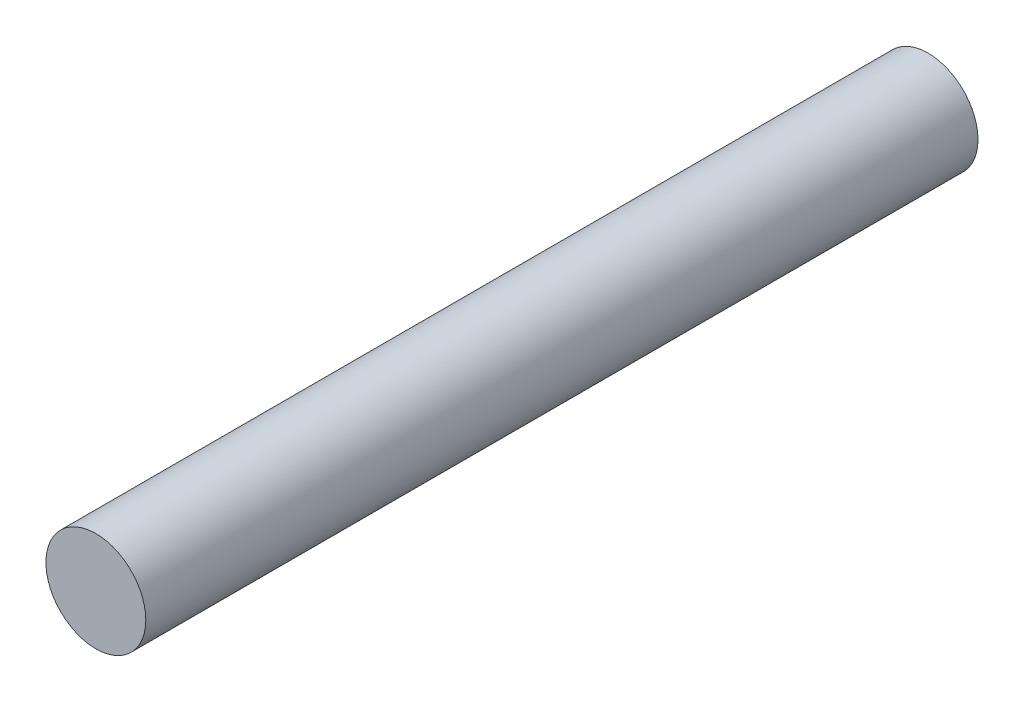
from build123d import *

# Parameters (mm, degrees)
SKETCH1_R           = 3
BOSS_EXTRUDE1_DEPTH = 50


with BuildPart() as part:
    # Sketch1 → Boss-Extrude1 (new body)
    with BuildSketch(Plane.XY):
        with Locations((-26.717064046, 0)):
            Circle(SKETCH1_R)
    extrude(amount=BOSS_EXTRUDE1_DEPTH)


solid = part.part
